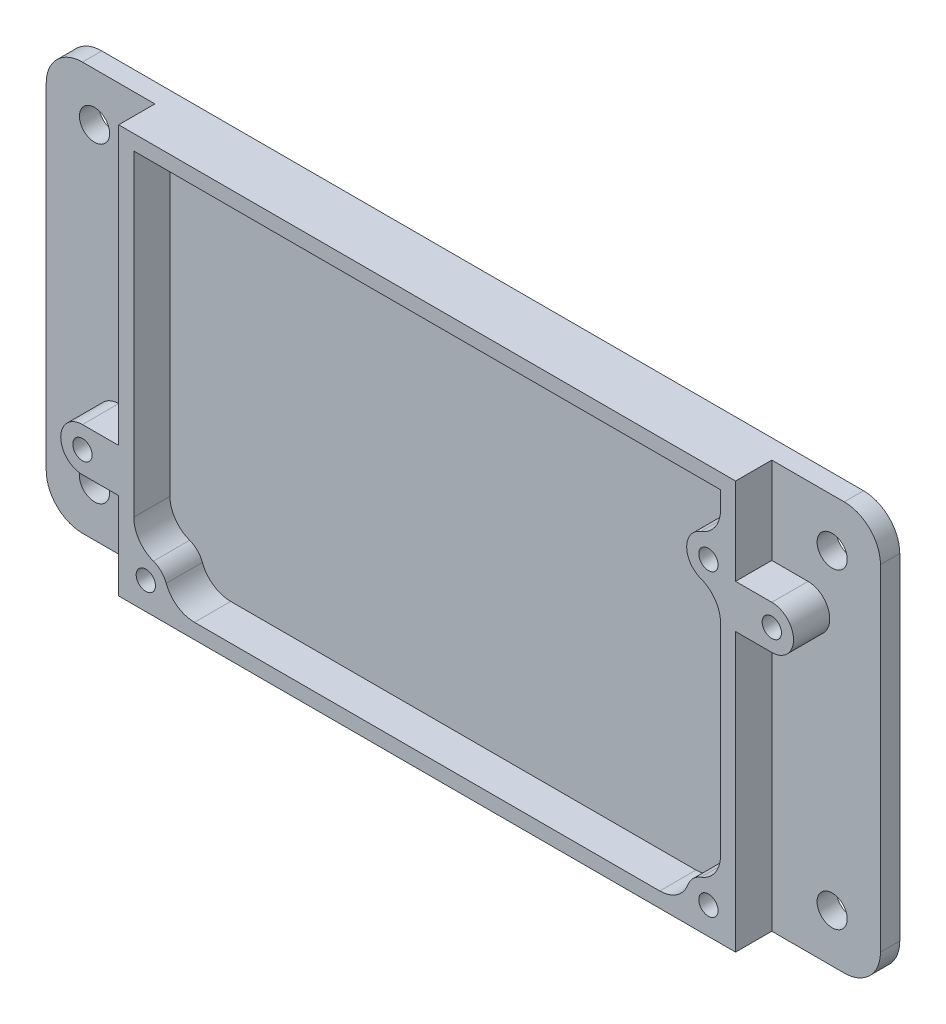
from build123d import *

# Parameters (mm, degrees)
SKETCH1_R           = 1.6
BOSS_EXTRUDE1_DEPTH = 6
SKETCH2_W           = 138.2
SKETCH2_H           = 67.6
SKETCH2_R           = 2.5
BOSS_EXTRUDE2_DEPTH = 3.2
FILLET1_R           = 6
FILLET2_R           = 5
FILLET3_R           = 5


with BuildPart() as part:
    # Sketch1 → Boss-Extrude1 (new body)
    with BuildSketch(Plane.XY):
        with BuildLine():
            Line((0, 21.6), (-6, 21.6))
            ThreePointArc((-6, 21.6), (-9.6, 18), (-6, 14.4))
            Line((-6, 14.4), (0, 14.4))
            Line((0, 14.4), (0, 0))
            Line((0, 0), (102.2, 0))
            Line((102.2, 0), (102.2, 46))
            Line((102.2, 46), (108.2, 46))
            ThreePointArc((108.2, 46), (111.8, 49.6), (108.2, 53.2))
            Line((108.2, 53.2), (102.2, 53.2))
            Line((102.2, 53.2), (102.2, 67.6))
            Line((102.2, 67.6), (0, 67.6))
            Line((0, 67.6), (0, 21.6))
        make_face()
        with Locations((-6, 18)):
            Circle(SKETCH1_R, mode=Mode.SUBTRACT)
        with BuildLine():
            Line((94.706674091, 2.5), (7.493325909, 2.5))
            ThreePointArc((7.493325909, 2.5), (7.045584412, 7.045584412), (2.5, 7.493325909))
            Line((2.5, 7.493325909), (2.5, 65.1))
            Line((2.5, 65.1), (99.7, 65.1))
            Line((99.7, 65.1), (99.7, 57.093325909))
            ThreePointArc((99.7, 57.093325909), (94.1, 54.1), (99.7, 51.106674091))
            Line((99.7, 51.106674091), (99.7, 7.493325909))
            ThreePointArc((99.7, 7.493325909), (95.154415588, 7.045584412), (94.706674091, 2.5))
        make_face(mode=Mode.SUBTRACT)
        with Locations((108.2, 49.6)):
            Circle(SKETCH1_R, mode=Mode.SUBTRACT)
        with Locations((4.5, 4.5)):
            Circle(SKETCH1_R, mode=Mode.SUBTRACT)
        with Locations((97.7, 4.5)):
            Circle(SKETCH1_R, mode=Mode.SUBTRACT)
        with Locations((97.7, 54.1)):
            Circle(SKETCH1_R, mode=Mode.SUBTRACT)
    extrude(amount=BOSS_EXTRUDE1_DEPTH)

    # Sketch2 → Boss-Extrude2 (add)
    with BuildSketch(Plane(origin=(0, 0, 0), x_dir=(-1, 0, 0), z_dir=(0, 0, -1))):
        with Locations((-51.1, 33.8)):
            Rectangle(SKETCH2_W, SKETCH2_H)
        with Locations((-112.2, 59.6)):
            Circle(SKETCH2_R, mode=Mode.SUBTRACT)
        with Locations((-112.2, 8)):
            Circle(SKETCH2_R, mode=Mode.SUBTRACT)
        with Locations(Location((10, 8, 0), (0, 0, 180))):
            Circle(SKETCH2_R, mode=Mode.SUBTRACT)
        with Locations(Location((10, 59.6, 0), (0, 0, 180))):
            Circle(SKETCH2_R, mode=Mode.SUBTRACT)
    extrude(amount=BOSS_EXTRUDE2_DEPTH)

    # Fillet1
    fillet1_edges = [part.edges().sort_by_distance(p)[0] for p in [
        (120.2, 67.6, -1.6),
        (120.2, 0, -1.6),
        (-18, 0, -1.6),
        (-18, 67.6, -1.6),
    ]]
    fillet(fillet1_edges, radius=FILLET1_R)

    # Fillet2
    fillet2_edges = [part.edges().sort_by_distance(p)[0] for p in [
        (99.7, 51.106674091, 3),
        (99.7, 57.093325909, 3),
    ]]
    fillet(fillet2_edges, radius=FILLET2_R)

    # Fillet3
    fillet3_edges = [part.edges().sort_by_distance(p)[0] for p in [
        (7.493325909, 2.5, 3),
        (94.706674091, 2.5, 3),
        (99.7, 7.493325909, 3),
        (2.5, 7.493325909, 3),
    ]]
    fillet(fillet3_edges, radius=FILLET3_R)


solid = part.part
